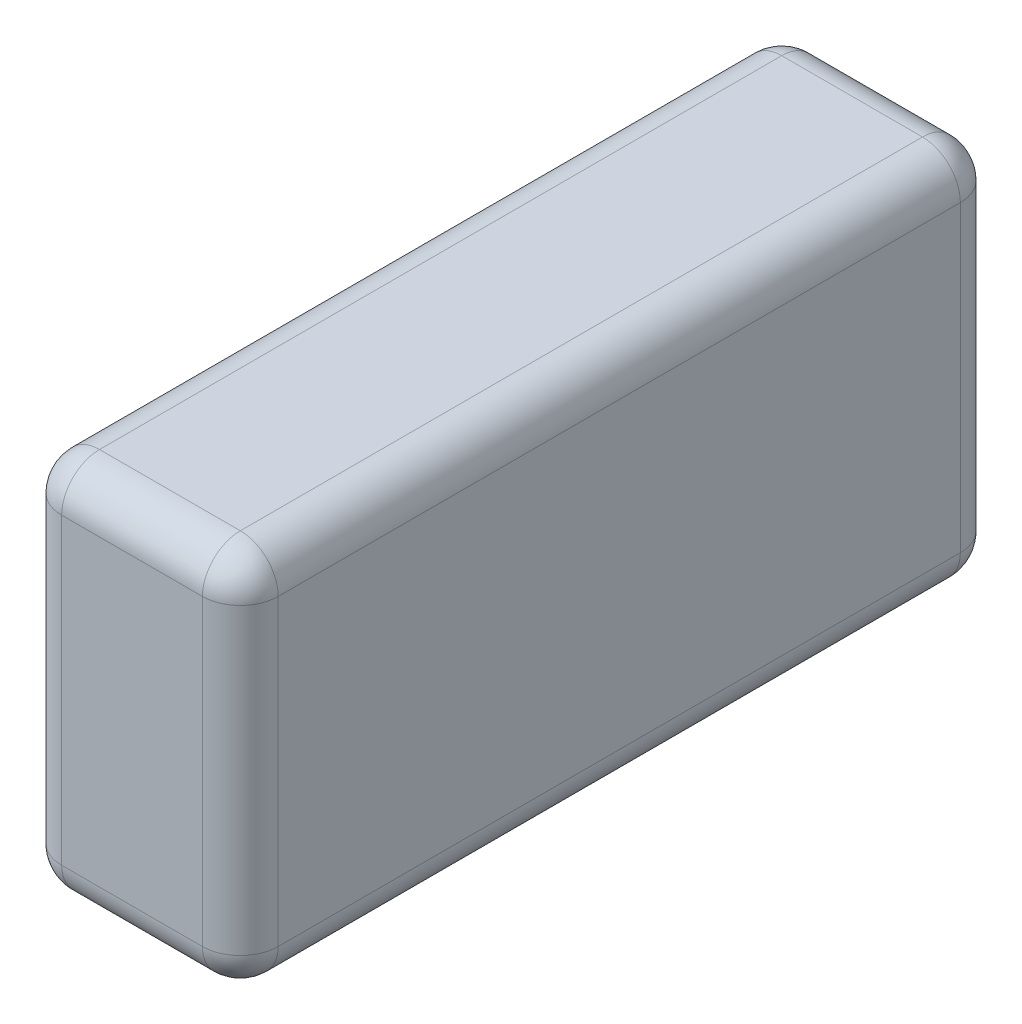
from build123d import *

# Parameters (mm, degrees)
SKETCH1_W           = 700
SKETCH1_H           = 350
BOSS_EXTRUDE1_DEPTH = 200
FILLET1_R           = 35


with BuildPart() as part:
    # Sketch1 → Boss-Extrude1 (new body)
    with BuildSketch(Plane(origin=(0, 0, 0), x_dir=(0, 0, -1), z_dir=(1, 0, 0))):
        with Locations((350, 175)):
            Rectangle(SKETCH1_W, SKETCH1_H)
    extrude(amount=-BOSS_EXTRUDE1_DEPTH)

    # Fillet1
    fillet1_edges = [part.edges().sort_by_distance(p)[0] for p in [
        (-200, 175, -700),
        (-200, 350, -350),
        (-200, 175, 0),
        (0, 350, -350),
        (0, 175, -700),
        (0, 0, -350),
        (0, 175, 0),
        (-200, 0, -350),
        (-100, 350, 0),
        (-100, 350, -700),
        (-100, 0, -700),
        (-100, 0, 0),
    ]]
    fillet(fillet1_edges, radius=FILLET1_R)


solid = part.part
